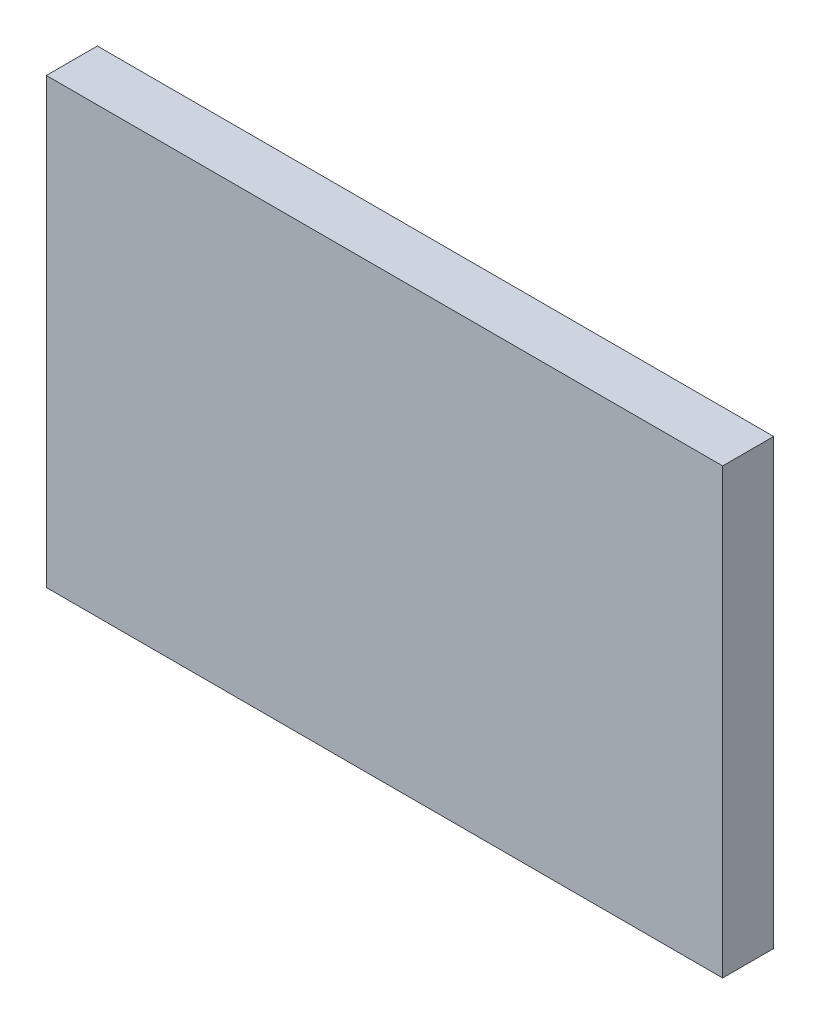
from build123d import *

# Parameters (mm, degrees)
SKETCH1_W           = 38.735
SKETCH1_H           = 25.4
BOSS_EXTRUDE1_DEPTH = 2.921


with BuildPart() as part:
    # Sketch1 → Boss-Extrude1 (new body)
    with BuildSketch(Plane.XY):
        with Locations((19.3675, 12.7)):
            Rectangle(SKETCH1_W, SKETCH1_H)
    extrude(amount=-BOSS_EXTRUDE1_DEPTH)


solid = part.part
